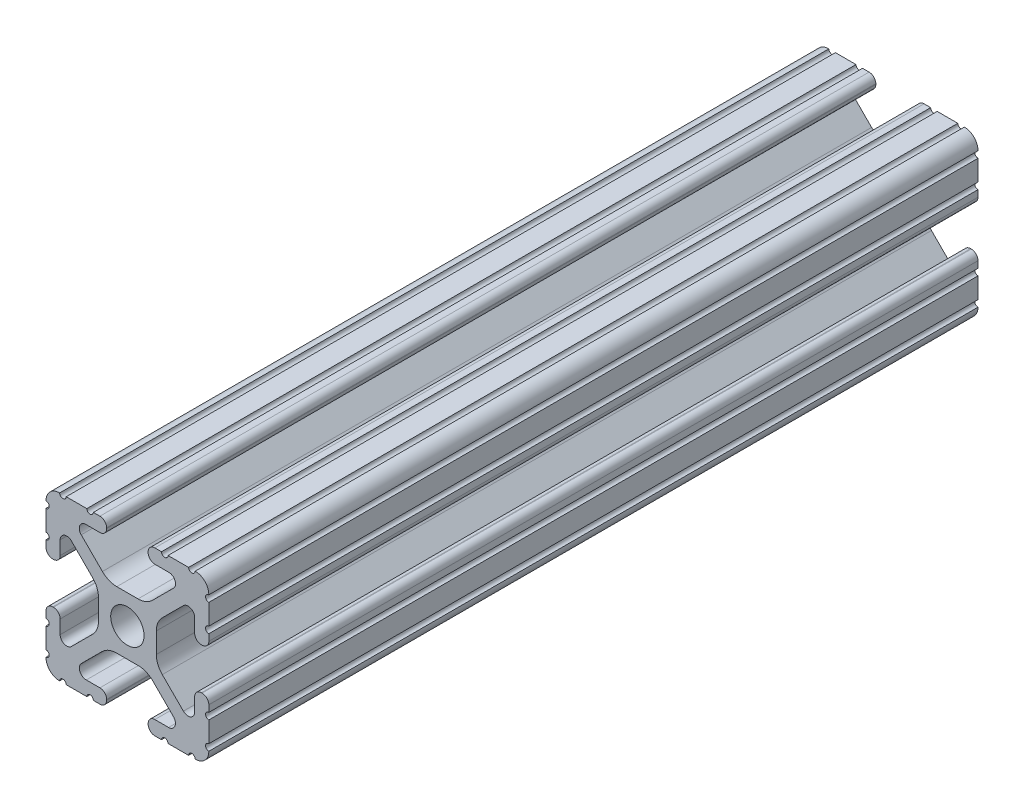
from build123d import *

# Parameters (mm, degrees)
SKETCH1_R           = 2.6035
BOSS_EXTRUDE1_DEPTH = 60


with BuildPart() as part:
    # Sketch1 → Boss-Extrude1 (new, symmetric)
    with BuildSketch(Plane.XY):
        with BuildLine():
            Line((-7.179650497, -8.645192506), (-3.952270251, -5.423690499))
            ThreePointArc((-3.952270251, -5.423690499), (-2.922936451, -4.736929036), (-1.709253557, -4.4958))
            Line((-1.709253557, -4.4958), (1.709253557, -4.4958))
            ThreePointArc((1.709253557, -4.4958), (2.922936451, -4.736929036), (3.952270251, -5.423690499))
            Line((3.952270251, -5.423690499), (7.179650497, -8.645192506))
            ThreePointArc((7.179650497, -8.645192506), (7.41473083, -9.822813117), (6.416408329, -10.4902))
            Line((6.416408329, -10.4902), (4.287512407, -10.4902))
            ThreePointArc((4.287512407, -10.4902), (3.54574862, -10.79744862), (3.2385, -11.539212407))
            Line((3.2385, -11.539212407), (3.2385, -11.650987593))
            ThreePointArc((3.2385, -11.650987593), (3.54574862, -12.39275138), (4.287512407, -12.7))
            Line((4.287512407, -12.7), (5.317126718, -12.7))
            ThreePointArc((5.317126718, -12.7), (5.825126718, -12.192), (6.333126718, -12.7))
            Line((6.333126718, -12.7), (9.550443118, -12.7))
            ThreePointArc((9.550443118, -12.7), (10.058366869, -12.192000006), (10.566443095, -12.699847501))
            ThreePointArc((10.566443095, -12.699847501), (12.082537762, -12.08250727), (12.699846982, -10.566399977))
            ThreePointArc((12.699846982, -10.566399977), (12.192000006, -10.058323491), (12.7, -9.5504))
            Line((12.7, -9.5504), (12.7, -6.3330836))
            ThreePointArc((12.7, -6.3330836), (12.192, -5.8250836), (12.7, -5.3170836))
            Line((12.7, -5.3170836), (12.7, -4.287469289))
            ThreePointArc((12.7, -4.287469289), (12.39275138, -3.545705502), (11.650987593, -3.238456882))
            Line((11.650987593, -3.238456882), (11.539212407, -3.238456882))
            ThreePointArc((11.539212407, -3.238456882), (10.79744862, -3.545705502), (10.4902, -4.287469289))
            Line((10.4902, -4.287469289), (10.4902, -6.402089023))
            ThreePointArc((10.4902, -6.402089023), (9.856505071, -7.351067942), (8.737131347, -7.129408934))
            Line((8.737131347, -7.129408934), (5.441005833, -3.840816462))
            ThreePointArc((5.441005833, -3.840816462), (4.750877967, -2.809883091), (4.5085, -1.593185507))
            Line((4.5085, -1.593185507), (4.5085, 1.593185507))
            ThreePointArc((4.5085, 1.593185507), (4.750877967, 2.809883091), (5.441005833, 3.840816462))
            Line((5.441005833, 3.840816462), (8.737131347, 7.129408934))
            ThreePointArc((8.737131347, 7.129408934), (9.856505071, 7.351067942), (10.4902, 6.402089023))
            Line((10.4902, 6.402089023), (10.4902, 4.287469289))
            ThreePointArc((10.4902, 4.287469289), (10.79744862, 3.545705502), (11.539212407, 3.238456882))
            Line((11.539212407, 3.238456882), (11.650987593, 3.238456882))
            ThreePointArc((11.650987593, 3.238456882), (12.39275138, 3.545705502), (12.7, 4.287469289))
            Line((12.7, 4.287469289), (12.7, 5.3170836))
            ThreePointArc((12.7, 5.3170836), (12.192, 5.8250836), (12.7, 6.3330836))
            Line((12.7, 6.3330836), (12.7, 9.5504))
            ThreePointArc((12.7, 9.5504), (12.192000006, 10.058323491), (12.699846982, 10.566399977))
            ThreePointArc((12.699846982, 10.566399977), (12.082537762, 12.08250727), (10.566443095, 12.699847501))
            ThreePointArc((10.566443095, 12.699847501), (10.058366869, 12.192000006), (9.550443118, 12.7))
            Line((9.550443118, 12.7), (6.333126718, 12.7))
            ThreePointArc((6.333126718, 12.7), (5.825126718, 12.192), (5.317126718, 12.7))
            Line((5.317126718, 12.7), (4.287512407, 12.7))
            ThreePointArc((4.287512407, 12.7), (3.54574862, 12.39275138), (3.2385, 11.650987593))
            Line((3.2385, 11.650987593), (3.2385, 11.539212407))
            ThreePointArc((3.2385, 11.539212407), (3.54574862, 10.79744862), (4.287512407, 10.4902))
            Line((4.287512407, 10.4902), (6.476788598, 10.4902))
            ThreePointArc((6.476788598, 10.4902), (7.432222385, 9.85140422), (7.207036008, 8.724370562))
            Line((7.207036008, 8.724370562), (3.898272566, 5.423169045))
            ThreePointArc((3.898272566, 5.423169045), (2.869120213, 4.736787962), (1.655778399, 4.4958))
            Line((1.655778399, 4.4958), (-1.655778399, 4.4958))
            ThreePointArc((-1.655778399, 4.4958), (-2.869120213, 4.736787962), (-3.898272566, 5.423169045))
            Line((-3.898272566, 5.423169045), (-7.207036008, 8.724370562))
            ThreePointArc((-7.207036008, 8.724370562), (-7.432222385, 9.85140422), (-6.476788598, 10.4902))
            Line((-6.476788598, 10.4902), (-4.287512407, 10.4902))
            ThreePointArc((-4.287512407, 10.4902), (-3.54574862, 10.79744862), (-3.2385, 11.539212407))
            Line((-3.2385, 11.539212407), (-3.2385, 11.650987593))
            ThreePointArc((-3.2385, 11.650987593), (-3.54574862, 12.39275138), (-4.287512407, 12.7))
            Line((-4.287512407, 12.7), (-5.317126718, 12.7))
            ThreePointArc((-5.317126718, 12.7), (-5.825126718, 12.192), (-6.333126718, 12.7))
            Line((-6.333126718, 12.7), (-9.550443118, 12.7))
            ThreePointArc((-9.550443118, 12.7), (-10.058366869, 12.192000006), (-10.566443095, 12.699847501))
            ThreePointArc((-10.566443095, 12.699847501), (-12.082537762, 12.08250727), (-12.699846982, 10.566399977))
            ThreePointArc((-12.699846982, 10.566399977), (-12.192000006, 10.058323491), (-12.7, 9.5504))
            Line((-12.7, 9.5504), (-12.7, 6.3330836))
            ThreePointArc((-12.7, 6.3330836), (-12.192, 5.8250836), (-12.7, 5.3170836))
            Line((-12.7, 5.3170836), (-12.7, 4.287469289))
            ThreePointArc((-12.7, 4.287469289), (-12.39275138, 3.545705502), (-11.650987593, 3.238456882))
            Line((-11.650987593, 3.238456882), (-11.539212407, 3.238456882))
            ThreePointArc((-11.539212407, 3.238456882), (-10.79744862, 3.545705502), (-10.4902, 4.287469289))
            Line((-10.4902, 4.287469289), (-10.4902, 6.402089023))
            ThreePointArc((-10.4902, 6.402089023), (-9.856505071, 7.351067942), (-8.737131347, 7.129408934))
            Line((-8.737131347, 7.129408934), (-5.441005833, 3.840816462))
            ThreePointArc((-5.441005833, 3.840816462), (-4.750877967, 2.809883091), (-4.5085, 1.593185507))
            Line((-4.5085, 1.593185507), (-4.5085, -1.593185507))
            ThreePointArc((-4.5085, -1.593185507), (-4.750877967, -2.809883091), (-5.441005833, -3.840816462))
            Line((-5.441005833, -3.840816462), (-8.737131347, -7.129408934))
            ThreePointArc((-8.737131347, -7.129408934), (-9.856505071, -7.351067942), (-10.4902, -6.402089023))
            Line((-10.4902, -6.402089023), (-10.4902, -4.287469289))
            ThreePointArc((-10.4902, -4.287469289), (-10.79744862, -3.545705502), (-11.539212407, -3.238456882))
            Line((-11.539212407, -3.238456882), (-11.650987593, -3.238456882))
            ThreePointArc((-11.650987593, -3.238456882), (-12.39275138, -3.545705502), (-12.7, -4.287469289))
            Line((-12.7, -4.287469289), (-12.7, -5.3170836))
            ThreePointArc((-12.7, -5.3170836), (-12.192, -5.8250836), (-12.7, -6.3330836))
            Line((-12.7, -6.3330836), (-12.7, -9.5504))
            ThreePointArc((-12.7, -9.5504), (-12.192000006, -10.058323491), (-12.699846982, -10.566399977))
            ThreePointArc((-12.699846982, -10.566399977), (-12.082537762, -12.08250727), (-10.566443095, -12.699847501))
            ThreePointArc((-10.566443095, -12.699847501), (-10.058366869, -12.192000006), (-9.550443118, -12.7))
            Line((-9.550443118, -12.7), (-6.333126718, -12.7))
            ThreePointArc((-6.333126718, -12.7), (-5.825126718, -12.192), (-5.317126718, -12.7))
            Line((-5.317126718, -12.7), (-4.287512407, -12.7))
            ThreePointArc((-4.287512407, -12.7), (-3.54574862, -12.39275138), (-3.2385, -11.650987593))
            Line((-3.2385, -11.650987593), (-3.2385, -11.539212407))
            ThreePointArc((-3.2385, -11.539212407), (-3.54574862, -10.79744862), (-4.287512407, -10.4902))
            Line((-4.287512407, -10.4902), (-6.416408329, -10.4902))
            ThreePointArc((-6.416408329, -10.4902), (-7.41473083, -9.822813117), (-7.179650497, -8.645192506))
        make_face()
        Circle(SKETCH1_R, mode=Mode.SUBTRACT)
    extrude(amount=BOSS_EXTRUDE1_DEPTH, both=True)


solid = part.part
